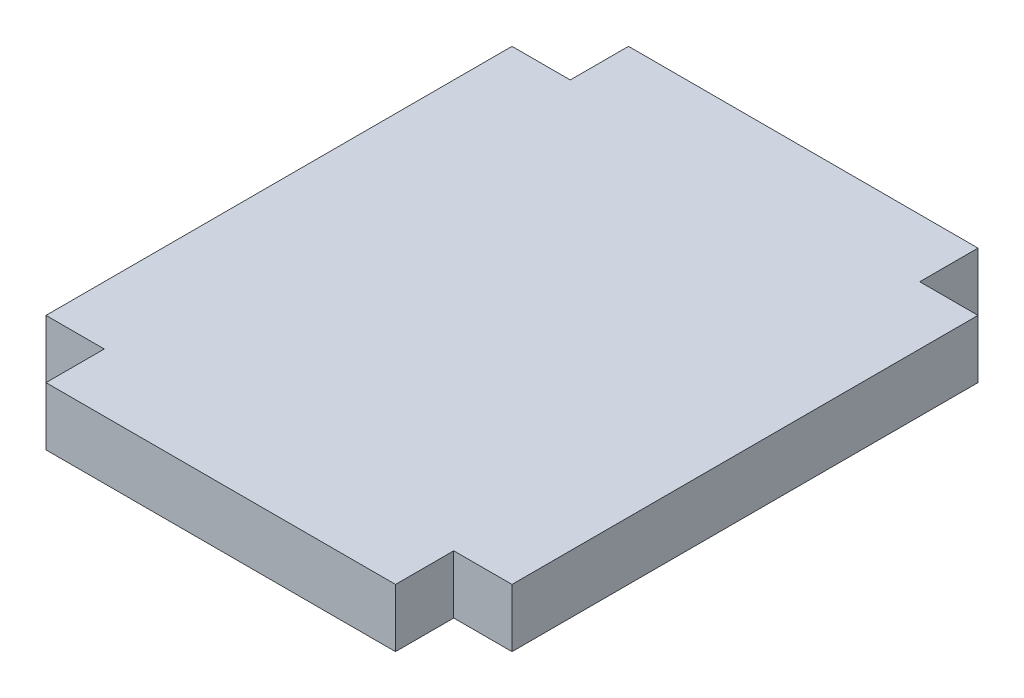
from build123d import *

# Parameters (mm, degrees)
SALIENTE_EXTRUIR1_DEPTH = 3


with BuildPart() as part:
    # Croquis1 → Saliente-Extruir1 (new body)
    with BuildSketch(Plane(origin=(0, 0, 0), x_dir=(1, 0, 0), z_dir=(0, 1, 0))):
        Polygon((0, 0), (18, 0), (18, 3), (21, 3), (21, 27), (18, 27), (18, 30), (0, 30), (0, 27), (-3, 27), (-3, 3), (0, 3), align=None)
    extrude(amount=SALIENTE_EXTRUIR1_DEPTH)


solid = part.part
